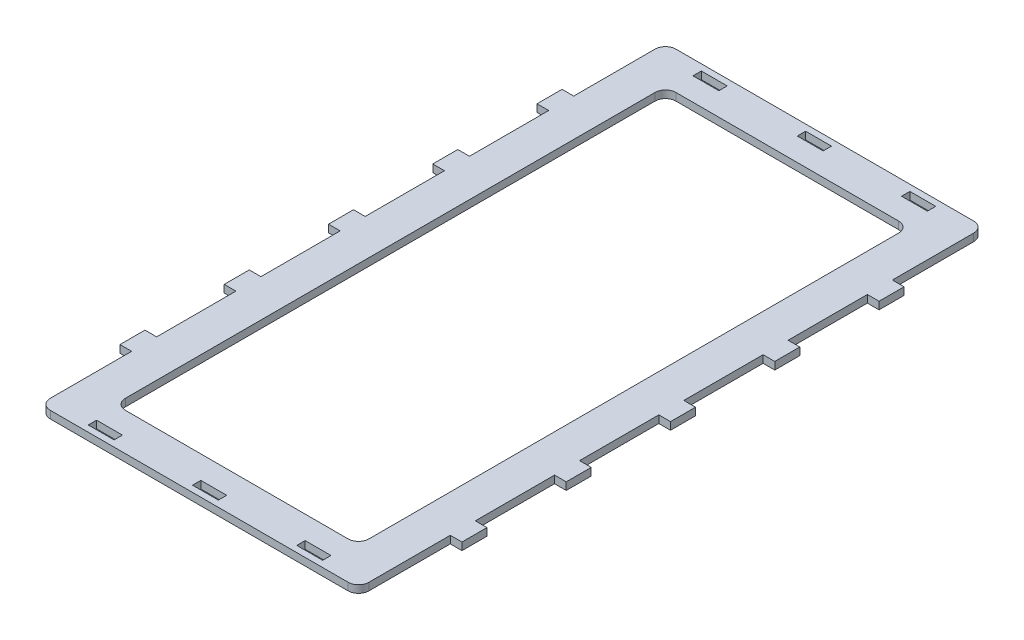
from build123d import *

# Parameters (mm, degrees)
SKETCH_1_W               = 764
SKETCH_1_H               = 1500
SKETCH_1_W_2             = 584
SKETCH_1_H_2             = 1320
EXTRUDE_1_DEPTH          = 18
SKETCH_1_3_W             = 28
SKETCH_1_3_H             = 60
EXTRUDE_2_DEPTH          = 18
PATTERN_LINEAR_1_COUNT   = 5
PATTERN_LINEAR_1_PITCH   = 250
MIRROR_1_COPY_1_SKETCH_W = 28
MIRROR_1_COPY_1_SKETCH_H = 60
MIRROR_1_COPY_1_DEPTH    = 18
MIRROR_1_COPY_2_SKETCH_W = 28
MIRROR_1_COPY_2_SKETCH_H = 60
MIRROR_1_COPY_2_DEPTH    = 18
MIRROR_1_COPY_3_SKETCH_W = 28
MIRROR_1_COPY_3_SKETCH_H = 60
MIRROR_1_COPY_3_DEPTH    = 18
MIRROR_1_COPY_4_SKETCH_W = 28
MIRROR_1_COPY_4_SKETCH_H = 60
MIRROR_1_COPY_4_DEPTH    = 18
SKETCH_1_4_W             = 62
SKETCH_1_4_H             = 20
CUT_EXTRUDE_1_DEPTH      = 855.940933632
PATTERN_LINEAR_2_COUNT   = 3
PATTERN_LINEAR_2_PITCH   = 250
MIRROR_2_COPY_1_SKETCH_W = 62
MIRROR_2_COPY_1_SKETCH_H = 20
MIRROR_2_COPY_1_DEPTH    = 855.940933632
MIRROR_2_COPY_2_SKETCH_W = 62
MIRROR_2_COPY_2_SKETCH_H = 20
MIRROR_2_COPY_2_DEPTH    = 855.940933632
FILLET_1_R               = 25
FILLET_2_R               = 25


with BuildPart() as part:
    # 草图1 → 凸台-拉伸1 (new body)
    with BuildSketch(Plane(origin=(0, 0, 0), x_dir=(1, 0, 0), z_dir=(0, 1, 0))):
        Rectangle(SKETCH_1_W, SKETCH_1_H)
        Rectangle(SKETCH_1_W_2, SKETCH_1_H_2, mode=Mode.SUBTRACT)
    extrude(amount=EXTRUDE_1_DEPTH)

    # 草图1<3> → 凸台-拉伸2 (add)
    with BuildSketch(Plane(origin=(0, 0, 0), x_dir=(1, 0, 0), z_dir=(0, 1, 0))):
        with Locations((-396, -500)):
            Rectangle(SKETCH_1_3_W, SKETCH_1_3_H)
    extrude_2 = extrude(amount=EXTRUDE_2_DEPTH)

    # 阵列(线性)1: 凸台-拉伸2 ×5
    with Locations(*[(0, 0, -i * PATTERN_LINEAR_1_PITCH) for i in range(1, PATTERN_LINEAR_1_COUNT)]):
        add(extrude_2)

    # 镜向1: 凸台-拉伸2 across plane
    add(extrude_2.mirror(Plane(origin=(0, 0, 0), x_dir=(0, 0, 1), z_dir=(1, 0, 0))))

    # 镜向1 copy 1 sketch → 镜向1 copy 1 (add)
    with BuildSketch(Plane(origin=(0, 0, -250), x_dir=(-1, 0, 0), z_dir=(0, 1, 0))):
        with Locations((-396, 500)):
            Rectangle(MIRROR_1_COPY_1_SKETCH_W, MIRROR_1_COPY_1_SKETCH_H)
    extrude(amount=MIRROR_1_COPY_1_DEPTH)

    # 镜向1 copy 2 sketch → 镜向1 copy 2 (add)
    with BuildSketch(Plane(origin=(0, 0, -500), x_dir=(-1, 0, 0), z_dir=(0, 1, 0))):
        with Locations((-396, 500)):
            Rectangle(MIRROR_1_COPY_2_SKETCH_W, MIRROR_1_COPY_2_SKETCH_H)
    extrude(amount=MIRROR_1_COPY_2_DEPTH)

    # 镜向1 copy 3 sketch → 镜向1 copy 3 (add)
    with BuildSketch(Plane(origin=(0, 0, -750), x_dir=(-1, 0, 0), z_dir=(0, 1, 0))):
        with Locations((-396, 500)):
            Rectangle(MIRROR_1_COPY_3_SKETCH_W, MIRROR_1_COPY_3_SKETCH_H)
    extrude(amount=MIRROR_1_COPY_3_DEPTH)

    # 镜向1 copy 4 sketch → 镜向1 copy 4 (add)
    with BuildSketch(Plane(origin=(0, 0, -1000), x_dir=(-1, 0, 0), z_dir=(0, 1, 0))):
        with Locations((-396, 500)):
            Rectangle(MIRROR_1_COPY_4_SKETCH_W, MIRROR_1_COPY_4_SKETCH_H)
    extrude(amount=MIRROR_1_COPY_4_DEPTH)

    # 草图1<4> → 切除-拉伸1 (cut, through all)
    with BuildSketch(Plane(origin=(0, 0, 0), x_dir=(1, 0, 0), z_dir=(0, 1, 0))):
        with Locations((-250, -725)):
            Rectangle(SKETCH_1_4_W, SKETCH_1_4_H)
    cut_extrude_1 = extrude(amount=CUT_EXTRUDE_1_DEPTH, mode=Mode.SUBTRACT)

    # 阵列(线性)2: 切除-拉伸1 ×3
    with Locations(*[(i * PATTERN_LINEAR_2_PITCH, 0, 0) for i in range(1, PATTERN_LINEAR_2_COUNT)]):
        add(cut_extrude_1, mode=Mode.SUBTRACT)

    # 镜向2: 切除-拉伸1 across plane
    add(cut_extrude_1.mirror(Plane.XY), mode=Mode.SUBTRACT)

    # 镜向2 copy 1 sketch → 镜向2 copy 1 (cut, through all)
    with BuildSketch(Plane(origin=(250, 0, 0), x_dir=(1, 0, 0), z_dir=(0, 1, 0))):
        with Locations((-250, 725)):
            Rectangle(MIRROR_2_COPY_1_SKETCH_W, MIRROR_2_COPY_1_SKETCH_H)
    extrude(amount=MIRROR_2_COPY_1_DEPTH, mode=Mode.SUBTRACT)

    # 镜向2 copy 2 sketch → 镜向2 copy 2 (cut, through all)
    with BuildSketch(Plane(origin=(500, 0, 0), x_dir=(1, 0, 0), z_dir=(0, 1, 0))):
        with Locations((-250, 725)):
            Rectangle(MIRROR_2_COPY_2_SKETCH_W, MIRROR_2_COPY_2_SKETCH_H)
    extrude(amount=MIRROR_2_COPY_2_DEPTH, mode=Mode.SUBTRACT)

    # 圆角1
    fillet_1_edges = [part.edges().sort_by_distance(p)[0] for p in [
        (-382, 9, -750),
        (-382, 9, 750),
        (382, 9, 750),
        (382, 9, -750),
    ]]
    fillet(fillet_1_edges, radius=FILLET_1_R)

    # 圆角2
    fillet_2_edges = [part.edges().sort_by_distance(p)[0] for p in [
        (292, 9, -660),
        (-292, 9, -660),
        (-292, 9, 660),
        (292, 9, 660),
    ]]
    fillet(fillet_2_edges, radius=FILLET_2_R)


solid = part.part
